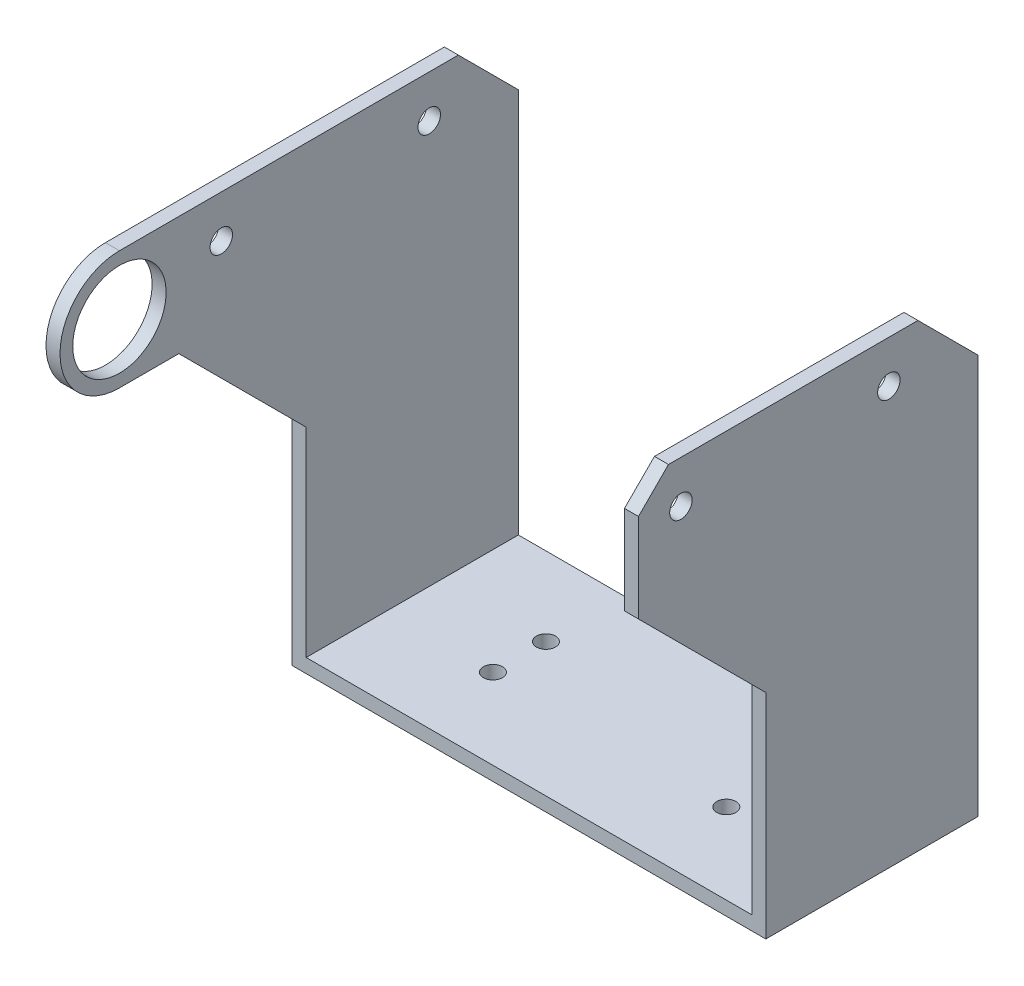
from build123d import *

# Parameters (mm, degrees)
SKETCH1_W           = 105
SKETCH1_H           = 50
SKETCH1_R           = 2.25
BOSS_EXTRUDE1_DEPTH = 3.3
SKETCH2_R           = 2.65
BOSS_EXTRUDE2_DEPTH = 3.3
BOSS_EXTRUDE3_START = 3.3
SKETCH3_R           = 11
SKETCH3_R_2         = 2.65
BOSS_EXTRUDE3_DEPTH = 3.3


with BuildPart() as part:
    # Sketch1 → Boss-Extrude1 (new body)
    with BuildSketch(Plane(origin=(0, 0, 0), x_dir=(1, 0, 0), z_dir=(0, 1, 0))):
        Rectangle(SKETCH1_W, SKETCH1_H)
        with Locations(Location((-27.5, 6.5, 0), (0, 0, 270))):
            Circle(SKETCH1_R, mode=Mode.SUBTRACT)
        with Locations(Location((-27.5, -6, 0), (0, 0, 270))):
            Circle(SKETCH1_R, mode=Mode.SUBTRACT)
        with Locations(Location((27.5, -6, 0), (0, 0, 90))):
            Circle(SKETCH1_R, mode=Mode.SUBTRACT)
        with Locations(Location((27.5, 6.5, 0), (0, 0, 90))):
            Circle(SKETCH1_R, mode=Mode.SUBTRACT)
    extrude(amount=BOSS_EXTRUDE1_DEPTH)

    # Sketch2 → Boss-Extrude2 (add)
    with BuildSketch(Plane(origin=(52.5, 0, 0), x_dir=(0, 0, -1), z_dir=(1, 0, 0))):
        Polygon((25, 0), (25, 94.157864376), (10.857864376, 108.3), (-47.928932188, 108.3), (-55, 101.228932188), (-55, 80.3), (-25, 50.3), (-25, 0), align=None)
        with Locations((-45, 98.3)):
            Circle(SKETCH2_R, mode=Mode.SUBTRACT)
        with Locations((4, 98.3)):
            Circle(SKETCH2_R, mode=Mode.SUBTRACT)
    extrude(amount=BOSS_EXTRUDE2_DEPTH)

    # Sketch3 → Boss-Extrude3 (add)
    with BuildSketch(Plane.ZY.offset(52.5).offset(BOSS_EXTRUDE3_START)):
        with BuildLine():
            Line((47.928932188, 108.3), (69, 108.3))
            ThreePointArc((69, 108.3), (83, 94.3), (69, 80.3))
            Line((69, 80.3), (55, 80.3))
            Line((55, 80.3), (25, 50.3))
            Line((25, 50.3), (25, 0))
            Line((25, 0), (-25, 0))
            Line((-25, 0), (-25, 94.157864376))
            Line((-25, 94.157864376), (-10.857864376, 108.3))
            Line((-10.857864376, 108.3), (47.928932188, 108.3))
        make_face()
        with Locations((69, 94.3)):
            Circle(SKETCH3_R, mode=Mode.SUBTRACT)
        with Locations(Location((-4, 98.3, 0), (0, 0, 180))):
            Circle(SKETCH3_R_2, mode=Mode.SUBTRACT)
        with Locations(Location((45, 98.3, 0), (0, 0, 180))):
            Circle(SKETCH3_R_2, mode=Mode.SUBTRACT)
    extrude(amount=-BOSS_EXTRUDE3_DEPTH)


solid = part.part
